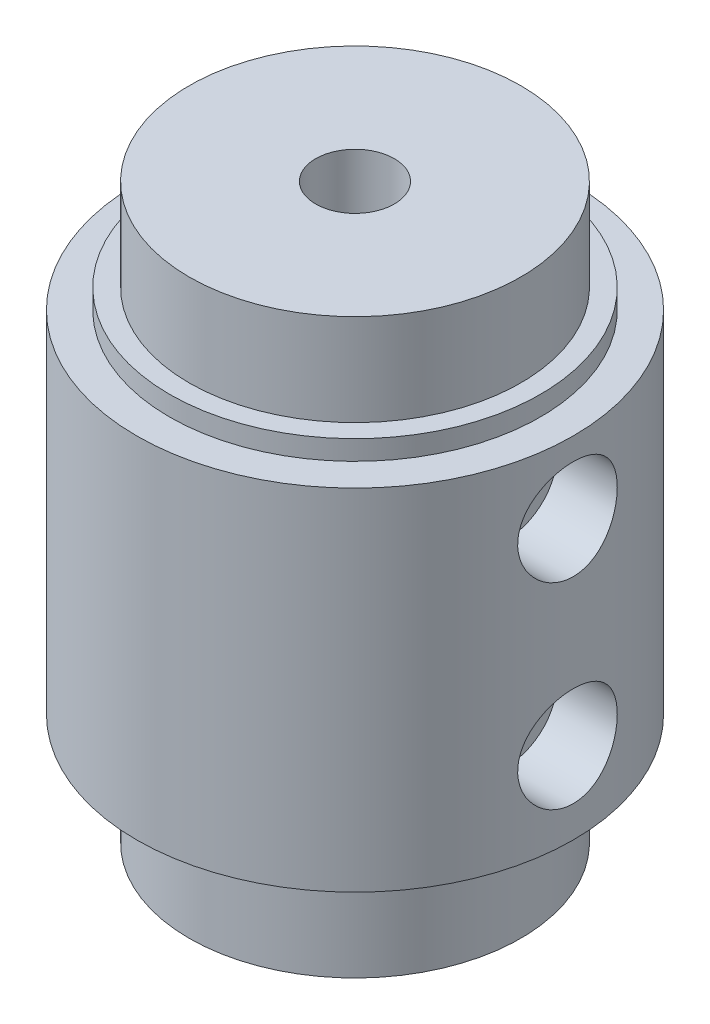
from build123d import *

# Parameters (mm, degrees)
SKETCH_1102_W          = 15.2
SKETCH_1102_H          = 15.2
CUT_EXTRUDE_1177_DEPTH = 34
SKETCH_1232_R          = 2.25
CUT_EXTRUDE_1504_DEPTH = 58.409080292
SKETCH_3_R             = 3.8
SKETCH_3_R_2           = 2.25
CUT_EXTRUDE_1538_DEPTH = 5
CUT_EXTRUDE_2118_DEPTH = 6


with BuildPart() as part:
    # Sketch 450 → Повернуть1 (revolve)
    with BuildSketch(Plane.XY):
        Polygon((3, 43.7), (12.65, 43.7), (12.65, 36.7), (14.15, 36.7), (14.15, 35.2), (16.65, 35.2), (16.65, 8.5), (14.15, 8.5), (14.15, 7), (12.65, 7), (12.65, 0), (0, 0), (0, 30.2), (3, 30.2), align=None)
    revolve(axis=Axis((0, 0, 0), (0, 1, 0)))

    # Sketch 1102 → Cut-Extrude 1177 (cut)
    with BuildSketch(Plane(origin=(0, 0, 0), x_dir=(-1, 0, 0), z_dir=(0, -1, 0))):
        Rectangle(SKETCH_1102_W, SKETCH_1102_H)
    extrude(amount=-CUT_EXTRUDE_1177_DEPTH, mode=Mode.SUBTRACT)

    # Sketch 1232 → Cut-Extrude 1504 (cut, through all)
    with BuildSketch(Plane(origin=(16.65, 0, 0), x_dir=(0, 0, -1), z_dir=(1, 0, 0))):
        with Locations((0, 29.7)):
            Circle(SKETCH_1232_R)
        with Locations((0, 14.7)):
            Circle(SKETCH_1232_R)
    extrude(amount=-CUT_EXTRUDE_1504_DEPTH, mode=Mode.SUBTRACT)

    # Sketch 3 → Cut-Extrude 1538 (cut)
    # profile 1 of 2: a face of its own
    with BuildSketch(Plane(origin=(16.65, 0, 0), x_dir=(0, 0, -1), z_dir=(1, 0, 0))):
        with Locations((0, 29.7)):
            Circle(SKETCH_3_R)
        with Locations((0, 29.7)):
            Circle(SKETCH_3_R_2, mode=Mode.SUBTRACT)
    # profile 2 of 2: a face of its own
    with BuildSketch(Plane(origin=(16.65, 0, 0), x_dir=(0, 0, -1), z_dir=(1, 0, 0))):
        with Locations((0, 14.7)):
            Circle(SKETCH_3_R)
        with Locations((0, 14.7)):
            Circle(SKETCH_3_R_2, mode=Mode.SUBTRACT)
    extrude(amount=-CUT_EXTRUDE_1538_DEPTH, mode=Mode.SUBTRACT)

    # Sketch 1662 → Cut-Extrude 2118 (cut)
    with BuildSketch(Plane.ZY.offset(16.65)):
        Polygon((3.55, 31.749593456), (0, 33.799186911), (-3.55, 31.749593456), (-3.55, 27.650406544), (0, 25.600813089), (3.55, 27.650406544), align=None)
        Polygon((3.55, 16.749593456), (0, 18.799186911), (-3.55, 16.749593456), (-3.55, 12.650406544), (0, 10.600813089), (3.55, 12.650406544), align=None)
    extrude(amount=-CUT_EXTRUDE_2118_DEPTH, mode=Mode.SUBTRACT)


solid = part.part
